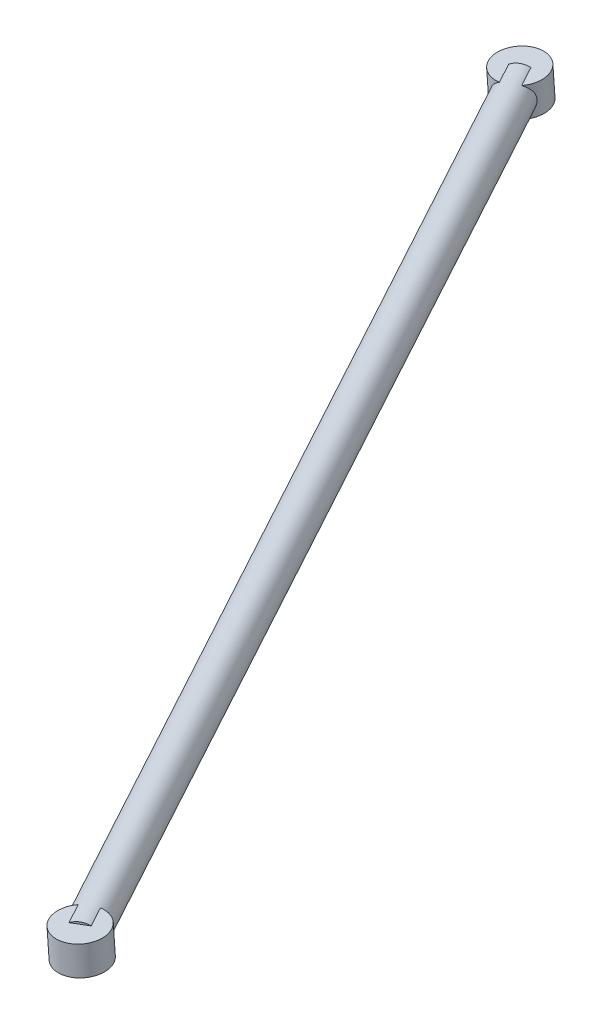
from build123d import *

# Parameters (mm, degrees)
SUSP_FR_PUSHROD_PROFILE_R                = 8
SUSP_FR_PUSHROD_ROD_END_MOUNT_PROFILE_R  = 11
SUSP_FR_PUSHROD_ROD_END_ROCKER_PROFILE_R = 11


with BuildPart() as part:
    # SUSP_FR_pushrod: sweep along a curve in space
    with BuildLine() as susp_fr_pushrod_path:
        Line((535.6, -114.51, -83.23), (308.5607, -96.2566, -516.2583))
    # SUSP_FR_pushrod profile (on start of the path) → SUSP_FR_pushrod (sweep)
    with BuildSketch(Plane(origin=(535.6, -114.51, -83.23), x_dir=(-0.8856507656122407, 0, 0.46435193697286564), z_dir=(-0.46402868322134944, 0.037306762161055766, -0.8850342290809543))):
        Circle(SUSP_FR_PUSHROD_PROFILE_R)
    sweep(path=susp_fr_pushrod_path.line)

    # SUSP_FR_pushrod_rod_end_mount: sweep along a curve in space
    with BuildLine() as susp_fr_pushrod_rod_end_mount_path:
        Line((535.464194, -107.5209, -82.8638843), (535.735806, -121.4991, -83.5961157))
    # SUSP_FR_pushrod_rod_end_mount profile (on start of the path) → SUSP_FR_pushrod_rod_end_mount (sweep)
    with BuildSketch(Plane(origin=(535.464194, -107.5209, -82.8638843), x_dir=(0, 0.052312087255056115, -0.9986307853891845), z_dir=(0.019400856591433174, -0.9984428287644381, -0.052302241370573335))):
        Circle(SUSP_FR_PUSHROD_ROD_END_MOUNT_PROFILE_R)
    sweep(path=susp_fr_pushrod_rod_end_mount_path.line)

    # SUSP_FR_pushrod_rod_end_rocker: sweep along a curve in space
    with BuildLine() as susp_fr_pushrod_rod_end_rocker_path:
        Line((308.424894, -89.2675002, -515.892184), (308.696506, -103.2457, -516.624416))
    # SUSP_FR_pushrod_rod_end_rocker profile (on start of the path) → SUSP_FR_pushrod_rod_end_rocker (sweep)
    with BuildSketch(Plane(origin=(308.424894, -89.2675002, -515.892184), x_dir=(0, 0.052312130749392324, -0.9986307831107845), z_dir=(0.019400856824669174, -0.9984428264819472, -0.05230228485648652))):
        Circle(SUSP_FR_PUSHROD_ROD_END_ROCKER_PROFILE_R)
    sweep(path=susp_fr_pushrod_rod_end_rocker_path.line)


solid = part.part
